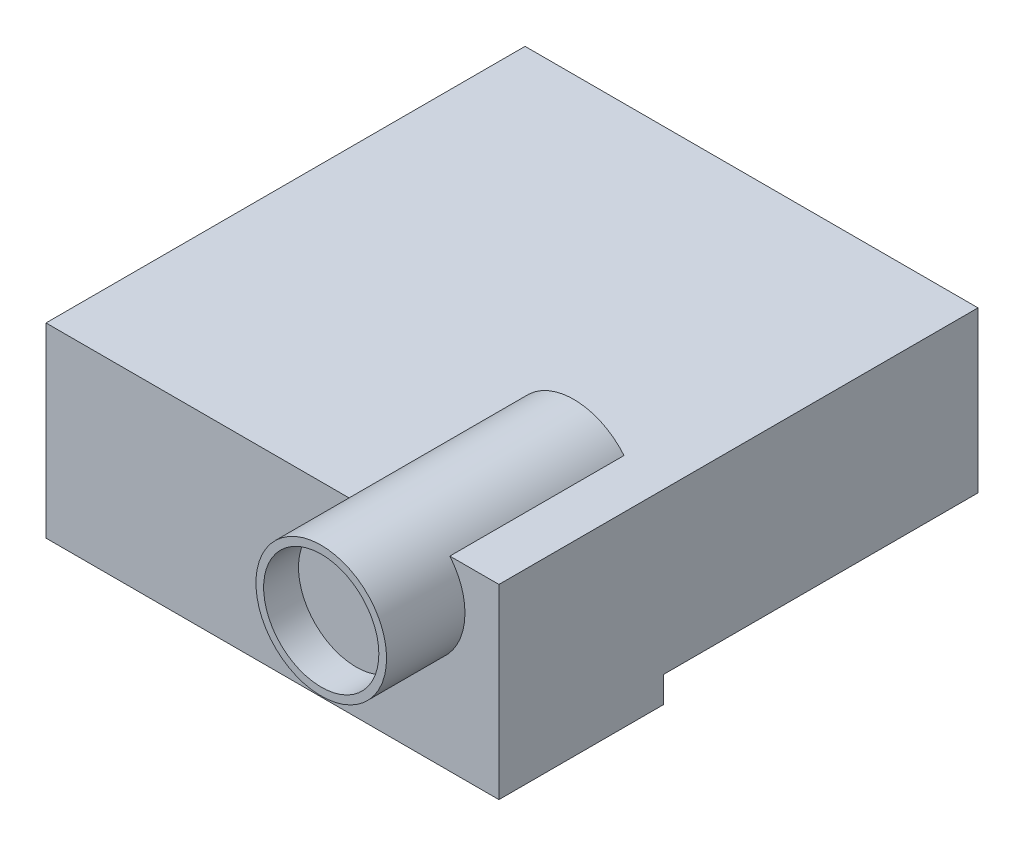
from build123d import *

# Parameters (mm, degrees)
SKETCH_1_W           = 260
SKETCH_1_H           = 275
EXTRUDE_1_DEPTH      = 107
EXTRUDE_2_DEPTH      = 25
EXTRUDE_2_DEPTH_BACK = 100
SKETCH_2_R           = 37.5
SKETCH_3_W           = 180.515861549
SKETCH_3_H           = 15
CUT_EXTRUDE_1_DEPTH  = 398.171562426
M4X0_7_1_D           = 3.3
M4X0_7_1_DEPTH       = 11.5
M4X0_7_1_TIP         = 0.991420021
M4X0_7_2_D           = 3.3
M4X0_7_2_DEPTH       = 11.5
M4X0_7_2_TIP         = 0.991420021
SKETCH_17_R          = 37.5
SKETCH_17_R_2        = 33.067386868
EXTRUDE_4_DEPTH      = 20


with BuildPart() as part:
    # 스케치1 → 보스-돌출1 (new body)
    with BuildSketch(Plane(origin=(0, 0, 0), x_dir=(1, 0, 0), z_dir=(0, 1, 0))):
        with Locations((130, 137.5)):
            Rectangle(SKETCH_1_W, SKETCH_1_H)
    extrude(amount=EXTRUDE_1_DEPTH)

    # 스케치2 → 보스-돌출2 (add, two sides: drawn at the far end of the back side and taken through both)
    with BuildSketch(Plane.XY.offset(-EXTRUDE_2_DEPTH_BACK)):
        with Locations((203, 83)):
            Circle(SKETCH_2_R)
    extrude(amount=EXTRUDE_2_DEPTH + EXTRUDE_2_DEPTH_BACK)

    # 스케치3 → 컷-돌출1 (cut, through all)
    with BuildSketch(Plane(origin=(260, 0, 0), x_dir=(0, 0, -1), z_dir=(1, 0, 0))):
        with Locations((184.742069226, 7.5)):
            Rectangle(SKETCH_3_W, SKETCH_3_H)
    extrude(amount=-CUT_EXTRUDE_1_DEPTH, mode=Mode.SUBTRACT)

    # M4x0.7 나사 구멍1
    with Locations(Plane(origin=(0, 15, 0), x_dir=(-1, 0, 0), z_dir=(0, -1, 0))):
        with Locations((-36, 235), (-209, 235)):
            Hole(M4X0_7_1_D / 2, depth=M4X0_7_1_DEPTH)
            with Locations((0, 0, -(M4X0_7_1_DEPTH + M4X0_7_1_TIP / 2))):  # 118° drill point
                Cone(0, M4X0_7_1_D / 2, M4X0_7_1_TIP, mode=Mode.SUBTRACT)

    # M4x0.7 나사 구멍2
    with Locations(Plane(origin=(0, 0, 0), x_dir=(-1, 0, 0), z_dir=(0, -1, 0))):
        with Locations((-142, 47)):
            Hole(M4X0_7_2_D / 2, depth=M4X0_7_2_DEPTH)
            with Locations((0, 0, -(M4X0_7_2_DEPTH + M4X0_7_2_TIP / 2))):  # 118° drill point
                Cone(0, M4X0_7_2_D / 2, M4X0_7_2_TIP, mode=Mode.SUBTRACT)

    # 스케치17 → 보스-돌출4 (add)
    with BuildSketch(Plane.XY.offset(25)):
        with Locations((203, 83)):
            Circle(SKETCH_17_R)
        with Locations((203, 83)):
            Circle(SKETCH_17_R_2, mode=Mode.SUBTRACT)
    extrude(amount=EXTRUDE_4_DEPTH)


solid = part.part
